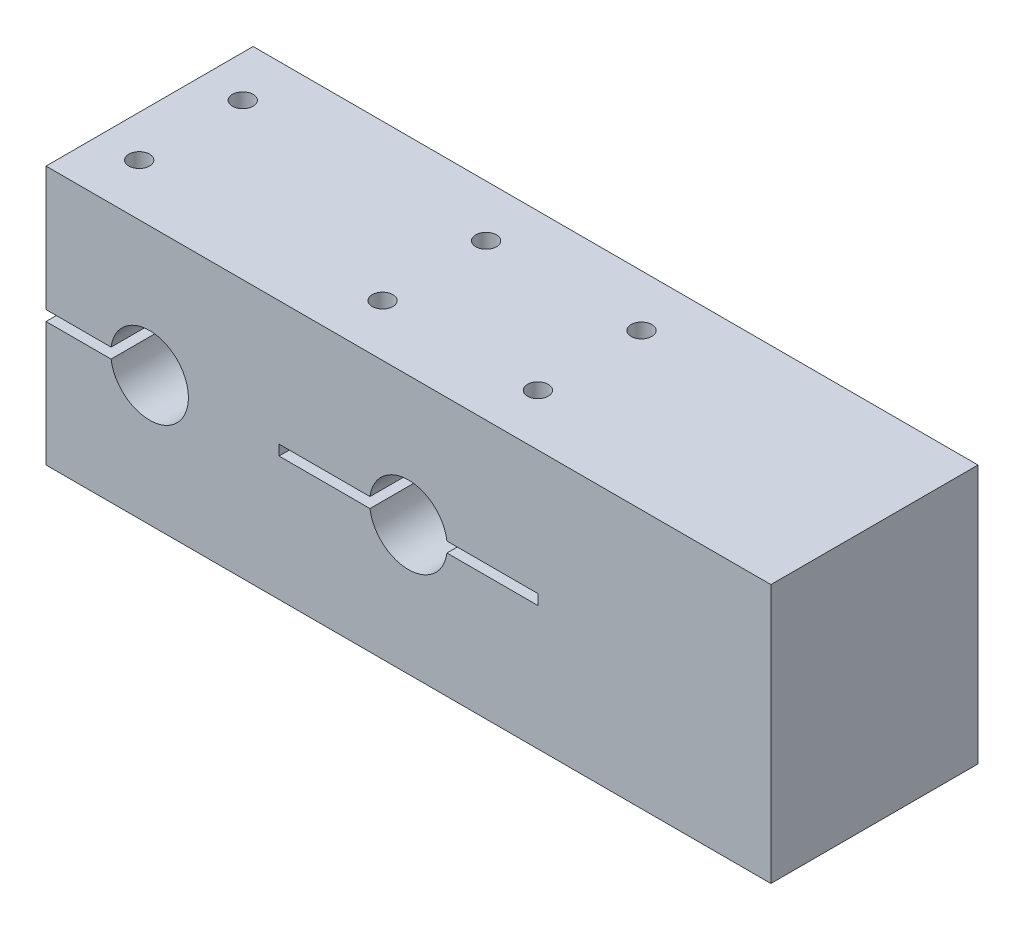
from build123d import *

# Parameters (mm, degrees)
EXTRUDE_1_DEPTH     = 40
SKETCH_8_R          = 2
CUT_EXTRUDE_5_DEPTH = 50


with BuildPart() as part:
    # Эскиз1 → Бобышка-Вытянуть1 (new body)
    with BuildSketch(Plane.XY):
        with BuildLine():
            Line((0, 0), (140, 0))
            Line((140, 0), (140, 34))
            Line((140, 34), (140, 50))
            Line((140, 50), (0, 50))
            Line((0, 50), (0, 26))
            Line((0, 26), (12.566965626, 26))
            ThreePointArc((12.566965626, 26), (27.5, 25), (12.566965626, 24))
            Line((12.566965626, 24), (0, 24))
            Line((0, 24), (0, 0))
        make_face()
        with BuildLine():
            Line((62.566965626, 26), (45, 26))
            Line((45, 26), (45, 24))
            Line((45, 24), (62.566965626, 24))
            ThreePointArc((62.566965626, 24), (70, 17.5), (77.433034374, 24))
            Line((77.433034374, 24), (94.997657208, 24))
            Line((94.997657208, 24), (94.997657208, 26))
            Line((94.997657208, 26), (77.433034374, 26))
            ThreePointArc((77.433034374, 26), (70, 32.5), (62.566965626, 26))
        make_face(mode=Mode.SUBTRACT)
    extrude(amount=EXTRUDE_1_DEPTH)

    # Эскиз8 → Вырез-Вытянуть5 (cut)
    with BuildSketch(Plane.XZ):
        with Locations(Location((8, 30, 0), (0, 0, 270))):
            Circle(SKETCH_8_R)
        with Locations(Location((8, 10, 0), (0, 0, 270))):
            Circle(SKETCH_8_R)
        with Locations(Location((55, 30, 0), (0, 0, 270))):
            Circle(SKETCH_8_R)
        with Locations(Location((55, 10, 0), (0, 0, 270))):
            Circle(SKETCH_8_R)
        with Locations(Location((85, 30, 0), (0, 0, 270))):
            Circle(SKETCH_8_R)
        with Locations(Location((85, 10, 0), (0, 0, 270))):
            Circle(SKETCH_8_R)
    extrude(amount=-CUT_EXTRUDE_5_DEPTH, mode=Mode.SUBTRACT)


solid = part.part
